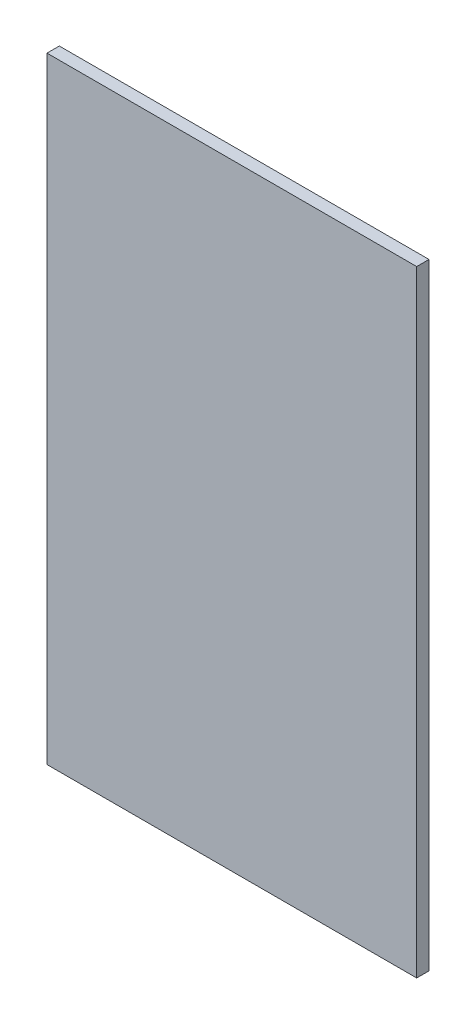
from build123d import *

# Parameters (mm, degrees)
ESQUISSE1_W        = 150
ESQUISSE1_H        = 250
BOSS_EXTRU_1_DEPTH = 5


with BuildPart() as part:
    # Esquisse1 → Boss.-Extru.1 (new body)
    with BuildSketch(Plane.XY):
        with Locations((50.632255691, 28.732076373)):
            Rectangle(ESQUISSE1_W, ESQUISSE1_H)
    extrude(amount=BOSS_EXTRU_1_DEPTH)


solid = part.part
